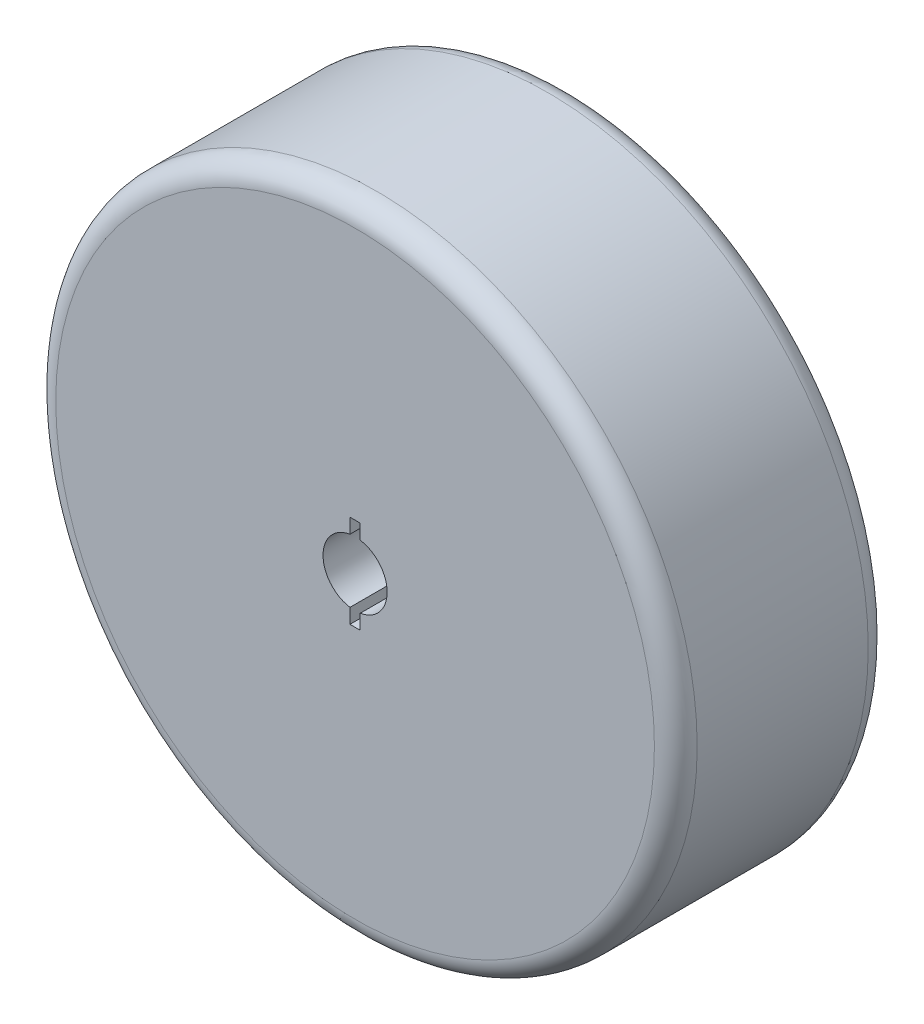
from build123d import *

# Parameters (mm, degrees)
SKETCH1_R           = 38.1
BOSS_EXTRUDE1_DEPTH = 25.4
CUT_EXTRUDE1_REACH  = 61.568
SKETCH2_R           = 3.81
FILLET1_R           = 2.54
FILLET2_R           = 2.54
CUT_EXTRUDE2_START  = -25.4
SKETCH3_W           = 1.220415144
SKETCH3_H           = 11.022652864
CUT_EXTRUDE2_DEPTH  = 25.4


with BuildPart() as part:
    # Sketch1 → Boss-Extrude1 (new body)
    with BuildSketch(Plane.XY):
        Circle(SKETCH1_R)
    extrude(amount=BOSS_EXTRUDE1_DEPTH)

    # Sketch2 → Cut-Extrude1 (cut, up to next)
    with BuildSketch(Plane.XY.offset(25.4), mode=Mode.PRIVATE) as cut_extrude1_sk1:
        Circle(SKETCH2_R)
    cut_extrude1_tool1 = extrude(cut_extrude1_sk1.sketch, amount=-CUT_EXTRUDE1_REACH, mode=Mode.PRIVATE) & part.part
    add(cut_extrude1_tool1.solids().sort_by_distance((0, 0, 25.4))[0], mode=Mode.SUBTRACT)

    # Fillet1
    fillet1_edges = [part.edges().sort_by_distance(p)[0] for p in [
        (-38.1, 0, 25.4),
    ]]
    fillet(fillet1_edges, radius=FILLET1_R)

    # Fillet2
    fillet2_edges = [part.edges().sort_by_distance(p)[0] for p in [
        (-38.1, 0, 0),
    ]]
    fillet(fillet2_edges, radius=FILLET2_R)

    # Sketch3 → Cut-Extrude2 (cut)
    with BuildSketch(Plane.XY.offset(25.4).offset(CUT_EXTRUDE2_START)):
        Rectangle(SKETCH3_W, SKETCH3_H)
    extrude(amount=CUT_EXTRUDE2_DEPTH, mode=Mode.SUBTRACT)


solid = part.part
